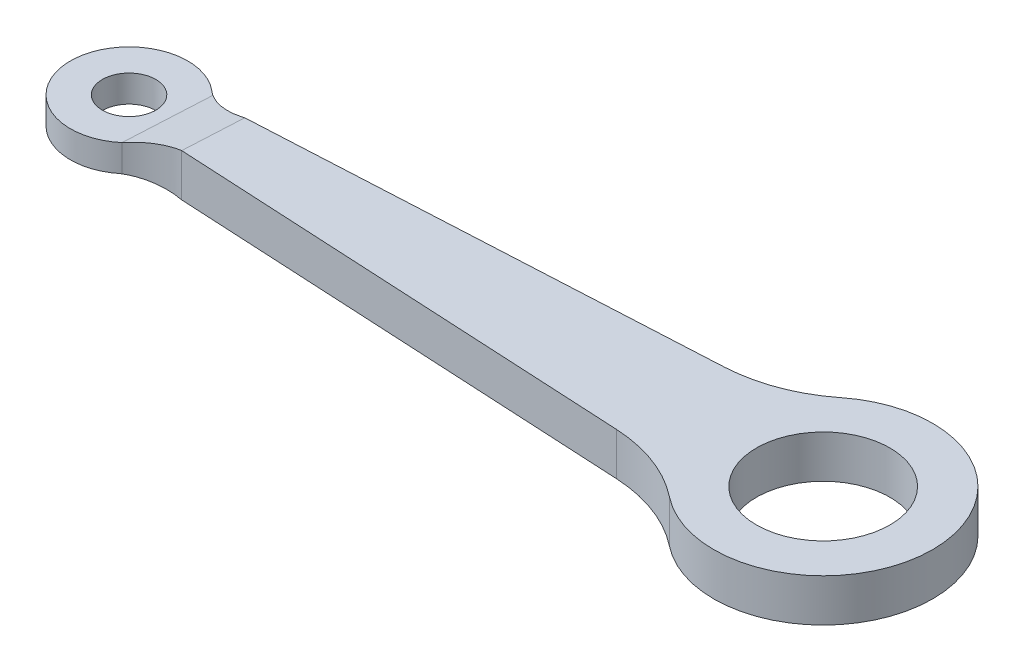
from build123d import *

# Parameters (mm, degrees)
BOSS_EXTRUDE1_DEPTH      = 1.27
BOSS_EXTRUDE1_DEPTH_BACK = 1.27
SKETCH1_R                = 1.5875
SKETCH1_R_2              = 3.96875
CUT_EXTRUDE1_DEPTH       = 49.548015703
CUT_EXTRUDE1_DEPTH_BACK  = 49.548015703
CUT_EXTRUDE2_DEPTH       = 49.548015703
CUT_EXTRUDE2_DEPTH_BACK  = 49.548015703


with BuildPart() as part:
    # Sketch1 → Boss-Extrude1 (new, two sides: drawn at the far end of the back side and taken through both)
    with BuildSketch(Plane(origin=(0, 0, 0), x_dir=(1, 0, 0), z_dir=(0, 1, 0)).offset(-BOSS_EXTRUDE1_DEPTH_BACK)):
        with BuildLine():
            Line((4.906744273, 1.778), (32.198389451, 3.208294517))
            ThreePointArc((32.198389451, 3.208294517), (34.867586322, 3.767022283), (37.24183541, 5.108562416))
            ThreePointArc((37.24183541, 5.108562416), (47.78375, 0), (37.24183541, -5.108562416))
            ThreePointArc((37.24183541, -5.108562416), (34.867586322, -3.767022283), (32.198389451, -3.208294517))
            Line((32.198389451, -3.208294517), (4.906744273, -1.778))
            ThreePointArc((4.906744273, -1.778), (3.494086568, -1.971116067), (2.251338568, -2.670024513))
            ThreePointArc((2.251338568, -2.670024513), (-3.4925, 0), (2.251338568, 2.670024513))
            ThreePointArc((2.251338568, 2.670024513), (3.494086568, 1.971116067), (4.906744273, 1.778))
        make_face()
        Circle(SKETCH1_R, mode=Mode.SUBTRACT)
        with Locations((41.275, 0)):
            Circle(SKETCH1_R_2, mode=Mode.SUBTRACT)
    extrude(amount=BOSS_EXTRUDE1_DEPTH + BOSS_EXTRUDE1_DEPTH_BACK)

    # Sketch2 → Cut-Extrude1 (cut, two sides: drawn at the far end of the back side and taken through both)
    with BuildSketch(Plane(origin=(-0.079485975, 0, 1.516682746), x_dir=(0.9986295347545739, 0, 0.05233595624294426), z_dir=(-0.05233595624294425, 0, 0.9986295347545738)).offset(-CUT_EXTRUDE1_DEPTH_BACK)):
        Polygon((-3.4925, 0.8001), (2.387991473, 0.8001), (4.99307308, 1.27), (4.99307308, 1.856442967), (-4.865374357, 1.856442967), align=None)
    extrude(amount=CUT_EXTRUDE1_DEPTH + CUT_EXTRUDE1_DEPTH_BACK, mode=Mode.SUBTRACT)

    # Sketch3 → Cut-Extrude2 (cut, two sides: drawn at the far end of the back side and taken through both)
    with BuildSketch(Plane(origin=(-0.079485975, 0, 1.516682746), x_dir=(0.9986295347545739, 0, 0.05233595624294426), z_dir=(-0.05233595624294425, 0, 0.9986295347545738)).offset(-CUT_EXTRUDE2_DEPTH_BACK)):
        Polygon((4.99307308, -1.27), (2.3495, -0.80386674), (-3.4925, -0.80386674), (-4.094294219, -2.202797579), (4.99307308, -2.202797579), align=None)
    extrude(amount=CUT_EXTRUDE2_DEPTH + CUT_EXTRUDE2_DEPTH_BACK, mode=Mode.SUBTRACT)


solid = part.part
